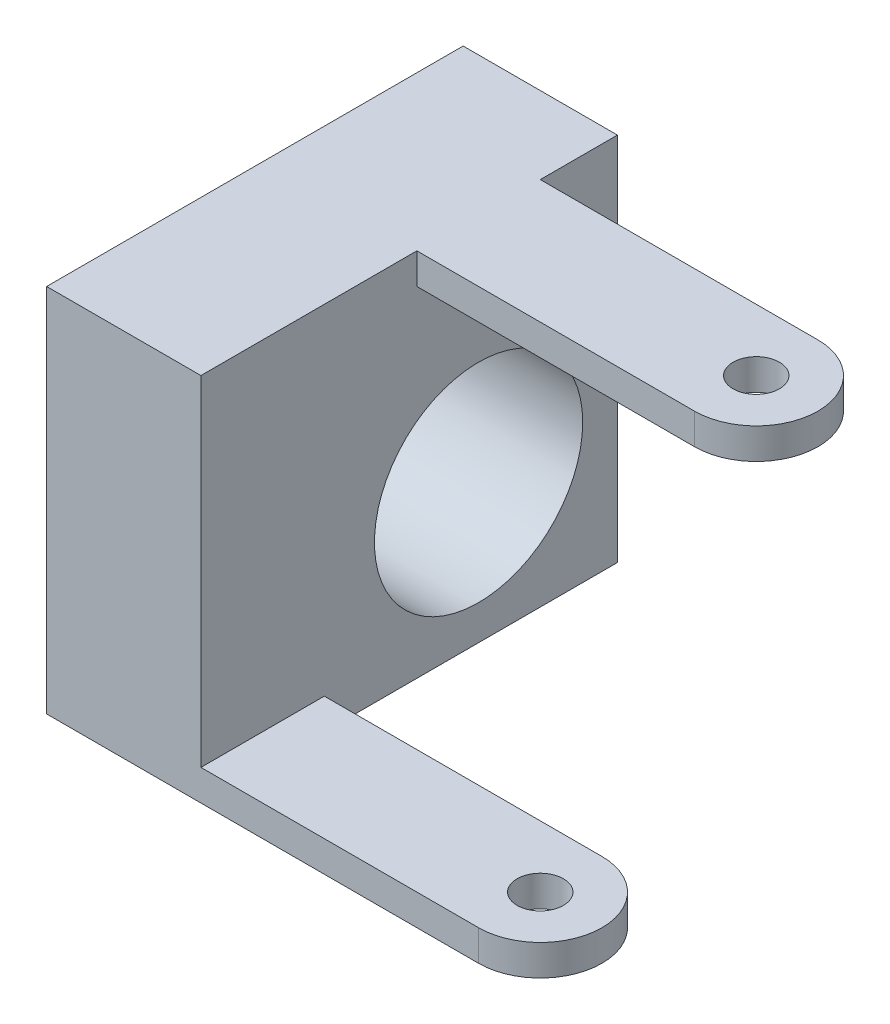
from build123d import *

# Parameters (mm, degrees)
SKETCH2_W           = 10
SKETCH2_H           = 27
BOSS_EXTRUDE1_DEPTH = 24
SKETCH3_R           = 6.75
CUT_EXTRUDE1_DEPTH  = 10
SKETCH6_W           = 8
SKETCH6_H           = 2
BOSS_EXTRUDE2_DEPTH = 22
FILLET1_RADIUS      = 4
FILLET1_LENGTH      = 2
SKETCH8_R           = 1.5
CUT_EXTRUDE2_DEPTH  = 2
SKETCH10_W          = 8
SKETCH10_H          = 2
BOSS_EXTRUDE3_DEPTH = 22
FILLET2_RADIUS      = 4
FILLET2_LENGTH      = 2
SKETCH11_R          = 1.5
CUT_EXTRUDE3_DEPTH  = 2


with BuildPart() as part:
    # Sketch2 → Boss-Extrude1 (new body)
    with BuildSketch(Plane(origin=(0, 0, 0), x_dir=(1, 0, 0), z_dir=(0, 1, 0))):
        with Locations((0, -4.5)):
            Rectangle(SKETCH2_W, SKETCH2_H)
    extrude(amount=BOSS_EXTRUDE1_DEPTH)

    # Sketch3 → Cut-Extrude1 (cut)
    with BuildSketch(Plane(origin=(5, 0, 0), x_dir=(0, 0, -1), z_dir=(1, 0, 0))):
        with Locations((0, 9)):
            Circle(SKETCH3_R)
    extrude(amount=-CUT_EXTRUDE1_DEPTH, mode=Mode.SUBTRACT)

    # Sketch6 → Boss-Extrude2 (add)
    with BuildSketch(Plane(origin=(5, 0, 0), x_dir=(0, 0, -1), z_dir=(1, 0, 0))):
        with Locations((0, 23)):
            Rectangle(SKETCH6_W, SKETCH6_H)
    extrude(amount=BOSS_EXTRUDE2_DEPTH)

    # Fillet1: full round fillet: the end face becomes a half cylinder, R = half its width
    fillet1_face = Plane((27, 23, 0), x_dir=(0, -1, 0), z_dir=(1, 0, 0))  # on the end face: x along it, z out of the body
    fillet1_slab = fillet1_face.offset(-FILLET1_RADIUS / 2) * Box(FILLET1_LENGTH, 2 * FILLET1_RADIUS, FILLET1_RADIUS, mode=Mode.PRIVATE)  # the body's end, R deep
    fillet1_round = Plane((23, 23, 0), x_dir=(1, 0, 0), z_dir=(0, -1, 0)) * Cylinder(FILLET1_RADIUS, FILLET1_LENGTH, mode=Mode.PRIVATE)  # its axis R under the face
    add(fillet1_slab - fillet1_round, mode=Mode.SUBTRACT)

    # Sketch8 → Cut-Extrude2 (cut)
    with BuildSketch(Plane(origin=(0, 24, 0), x_dir=(1, 0, 0), z_dir=(0, 1, 0))):
        with Locations(Location((23, 0, 0), (0, 0, 270))):
            Circle(SKETCH8_R)
    extrude(amount=-CUT_EXTRUDE2_DEPTH, mode=Mode.SUBTRACT)

    # Sketch10 → Boss-Extrude3 (add)
    with BuildSketch(Plane(origin=(5, 0, 0), x_dir=(0, 0, -1), z_dir=(1, 0, 0))):
        with Locations((-14, 1)):
            Rectangle(SKETCH10_W, SKETCH10_H)
    extrude(amount=BOSS_EXTRUDE3_DEPTH)

    # Fillet2: full round fillet: the end face becomes a half cylinder, R = half its width
    fillet2_face = Plane((27, 1, 14), x_dir=(0, -1, 0), z_dir=(1, 0, 0))  # on the end face: x along it, z out of the body
    fillet2_slab = fillet2_face.offset(-FILLET2_RADIUS / 2) * Box(FILLET2_LENGTH, 2 * FILLET2_RADIUS, FILLET2_RADIUS, mode=Mode.PRIVATE)  # the body's end, R deep
    fillet2_round = Plane((23, 1, 14), x_dir=(1, 0, 0), z_dir=(0, -1, 0)) * Cylinder(FILLET2_RADIUS, FILLET2_LENGTH, mode=Mode.PRIVATE)  # its axis R under the face
    add(fillet2_slab - fillet2_round, mode=Mode.SUBTRACT)

    # Sketch11 → Cut-Extrude3 (cut)
    with BuildSketch(Plane(origin=(0, 2, 0), x_dir=(1, 0, 0), z_dir=(0, 1, 0))):
        with Locations(Location((23, -14, 0), (0, 0, 270))):
            Circle(SKETCH11_R)
    extrude(amount=-CUT_EXTRUDE3_DEPTH, mode=Mode.SUBTRACT)


solid = part.part
